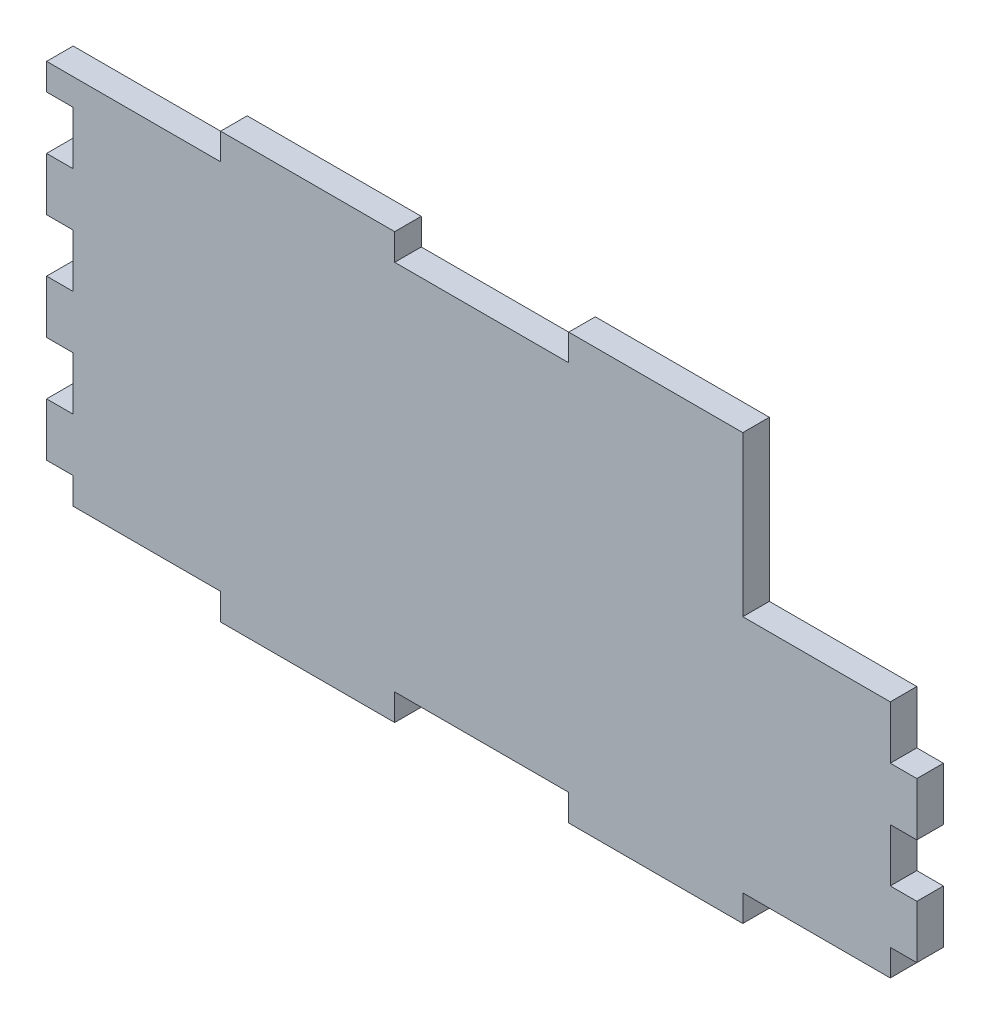
from build123d import *

# Parameters (mm, degrees)
SKETCH1_W           = 207.9625
SKETCH1_H           = 101.6
BOSS_EXTRUDE1_DEPTH = 6.35
SKETCH2_W           = 41.5925
SKETCH2_H           = 6.35
SKETCH2_W_2         = 35.2425
SKETCH2_W_3         = 6.35
SKETCH2_H_2         = 12.7
CUT_EXTRUDE1_DEPTH  = 6.35
SKETCH3_W           = 41.5925
SKETCH3_H           = 31.75
CUT_EXTRUDE2_DEPTH  = 6.35


with BuildPart() as part:
    # Sketch1 → Boss-Extrude1 (new body)
    with BuildSketch(Plane.XY):
        Rectangle(SKETCH1_W, SKETCH1_H)
    extrude(amount=BOSS_EXTRUDE1_DEPTH)

    # Sketch2 → Cut-Extrude1 (cut)
    with BuildSketch(Plane.XY.offset(6.35)):
        with Locations((0, 47.625)):
            Rectangle(SKETCH2_W, SKETCH2_H)
        with Locations((-83.185, 47.625)):
            Rectangle(SKETCH2_W, SKETCH2_H)
        with Locations((83.185, 47.625)):
            Rectangle(SKETCH2_W, SKETCH2_H)
        with Locations((80.01, -47.625)):
            Rectangle(SKETCH2_W_2, SKETCH2_H)
        with Locations((100.80625, -47.625)):
            Rectangle(SKETCH2_W_3, SKETCH2_H)
        with Locations((100.80625, -41.275)):
            Rectangle(SKETCH2_W_3, SKETCH2_H)
        with Locations((0, -47.625)):
            Rectangle(SKETCH2_W, SKETCH2_H)
        with Locations((-100.80625, -41.275)):
            Rectangle(SKETCH2_W_3, SKETCH2_H)
        with Locations((-100.80625, -47.625)):
            Rectangle(SKETCH2_W_3, SKETCH2_H)
        with Locations((-80.01, -47.625)):
            Rectangle(SKETCH2_W_2, SKETCH2_H)
        with Locations((-100.80625, 31.75)):
            Rectangle(SKETCH2_W_3, SKETCH2_H_2)
        with Locations((-100.80625, 6.35)):
            Rectangle(SKETCH2_W_3, SKETCH2_H_2)
        with Locations((-100.80625, -19.05)):
            Rectangle(SKETCH2_W_3, SKETCH2_H_2)
        with Locations((100.80625, -19.05)):
            Rectangle(SKETCH2_W_3, SKETCH2_H_2)
        with Locations((100.80625, 6.35)):
            Rectangle(SKETCH2_W_3, SKETCH2_H_2)
        with Locations((100.80625, 31.75)):
            Rectangle(SKETCH2_W_3, SKETCH2_H_2)
    extrude(amount=-CUT_EXTRUDE1_DEPTH, mode=Mode.SUBTRACT)

    # Sketch3 → Cut-Extrude2 (cut)
    with BuildSketch(Plane.XY.offset(6.35)):
        with Locations((83.185, 28.575)):
            Rectangle(SKETCH3_W, SKETCH3_H)
    extrude(amount=-CUT_EXTRUDE2_DEPTH, mode=Mode.SUBTRACT)


solid = part.part
